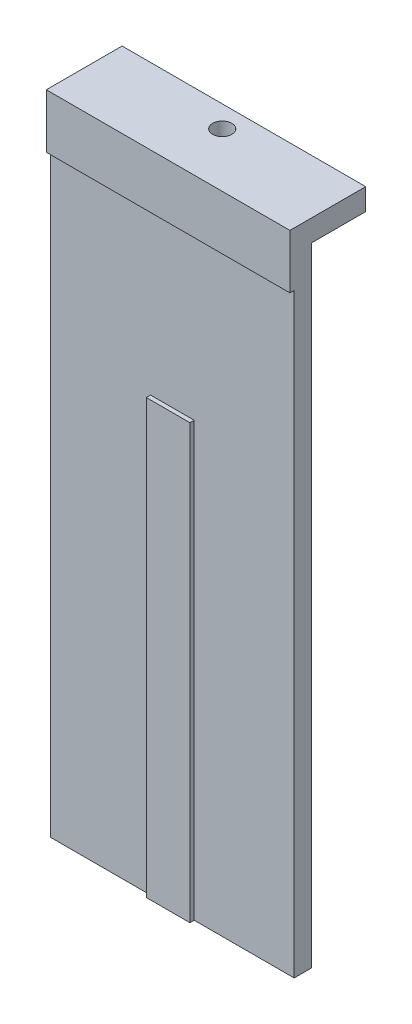
from build123d import *

# Parameters (mm, degrees)
SKETCH1_W           = 57.15
SKETCH1_H           = 5.08
BOSS_EXTRUDE1_DEPTH = 152.4
CUT_EXTRUDE1_DEPTH  = 1
SKETCH3_W           = 57.15
SKETCH3_H           = 5.08
BOSS_EXTRUDE2_DEPTH = 12.7
SKETCH4_R           = 2.25
CUT_EXTRUDE2_DEPTH  = 12.7


with BuildPart() as part:
    # Sketch1 → Boss-Extrude1 (new body)
    with BuildSketch(Plane(origin=(0, 0, 0), x_dir=(1, 0, 0), z_dir=(0, 1, 0))):
        Rectangle(SKETCH1_W, SKETCH1_H)
    extrude(amount=-BOSS_EXTRUDE1_DEPTH)

    # Sketch2 → Cut-Extrude1 (cut)
    with BuildSketch(Plane.XY.offset(2.54)):
        Polygon((-5.125, -152.4), (-5.125, -50.8), (5.125, -50.8), (5.125, -152.4), (28.575, -152.4), (28.575, -12.7), (-28.575, -12.7), (-28.575, -152.4), align=None)
    extrude(amount=-CUT_EXTRUDE1_DEPTH, mode=Mode.SUBTRACT)

    # Sketch3 → Boss-Extrude2 (add)
    with BuildSketch(Plane(origin=(0, 0, -2.54), x_dir=(-1, 0, 0), z_dir=(0, 0, -1))):
        with Locations((0, -2.54)):
            Rectangle(SKETCH3_W, SKETCH3_H)
    extrude(amount=BOSS_EXTRUDE2_DEPTH)

    # Sketch4 → Cut-Extrude2 (cut)
    with BuildSketch(Plane(origin=(0, 0, 0), x_dir=(1, 0, 0), z_dir=(0, 1, 0))):
        with Locations(Location((0, 10.16, 0), (0, 0, 270))):
            Circle(SKETCH4_R)
    extrude(amount=-CUT_EXTRUDE2_DEPTH, mode=Mode.SUBTRACT)


solid = part.part
